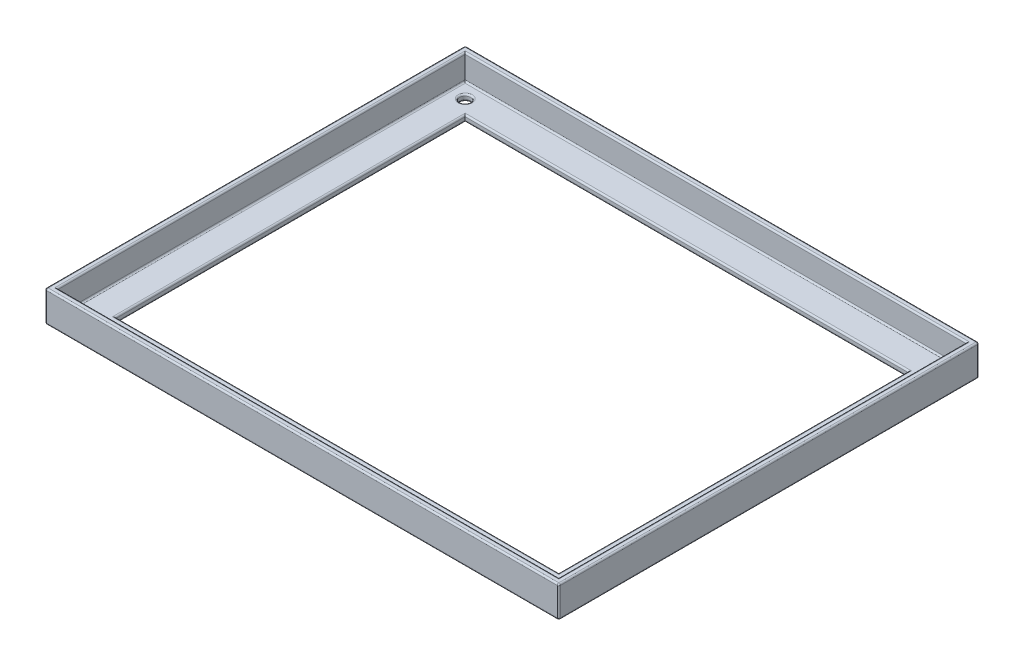
from build123d import *

# Parameters (mm, degrees)
SKETCH1_W           = 160.6
SKETCH1_H           = 130.6
SKETCH1_R           = 1.75
SKETCH1_W_2         = 142
SKETCH1_H_2         = 112
BOSS_EXTRUDE1_DEPTH = 2
SKETCH1_3_W         = 164.6
SKETCH1_3_H         = 134.6
SKETCH1_3_W_2       = 160.6
SKETCH1_3_H_2       = 130.6
BOSS_EXTRUDE2_DEPTH = 10
FILLET1_R           = 0.5


with BuildPart() as part:
    # Sketch1 → Boss-Extrude1 (new body)
    with BuildSketch(Plane(origin=(0, 0, 0), x_dir=(1, 0, 0), z_dir=(0, 1, 0))):
        with Locations((80, 65)):
            Rectangle(SKETCH1_W, SKETCH1_H)
        with Locations((4.5, 125.5)):
            Circle(SKETCH1_R, mode=Mode.SUBTRACT)
        with Locations((80, 65)):
            Rectangle(SKETCH1_W_2, SKETCH1_H_2, mode=Mode.SUBTRACT)
        with Locations((4.5, 4.5)):
            Circle(SKETCH1_R, mode=Mode.SUBTRACT)
        with Locations((155.5, 4.5)):
            Circle(SKETCH1_R, mode=Mode.SUBTRACT)
        with Locations((155.5, 125.5)):
            Circle(SKETCH1_R, mode=Mode.SUBTRACT)
    extrude(amount=BOSS_EXTRUDE1_DEPTH)

    # Sketch1<3> → Boss-Extrude2 (add)
    with BuildSketch(Plane(origin=(0, 0, 0), x_dir=(1, 0, 0), z_dir=(0, 1, 0))):
        with Locations((80, 65)):
            Rectangle(SKETCH1_3_W, SKETCH1_3_H)
        with Locations((80, 65)):
            Rectangle(SKETCH1_3_W_2, SKETCH1_3_H_2, mode=Mode.SUBTRACT)
    extrude(amount=BOSS_EXTRUDE2_DEPTH)

    # Fillet1
    fillet1_edges = [part.edges().sort_by_distance(p)[0] for p in [
        (162.3, 5, -132.3),
        (162.3, 5, 2.3),
        (-2.3, 5, -132.3),
        (-2.3, 5, 2.3),
        (-2.3, 0, -65),
        (80, 0, 2.3),
        (162.3, 0, -65),
        (80, 0, -132.3),
        (153.75, 0, -125.5),
        (153.75, 0, -4.5),
        (2.75, 0, -4.5),
        (2.75, 0, -125.5),
        (151, 0, -65),
        (80, 0, -9),
        (9, 0, -65),
        (80, 0, -121),
        (162.3, 10, -65),
        (80, 10, 2.3),
        (-2.3, 10, -65),
        (80, 10, -132.3),
        (80, 10, 0.3),
        (160.3, 10, -65),
        (80, 10, -130.3),
        (-0.3, 10, -65),
        (153.75, 2, -125.5),
        (153.75, 2, -4.5),
        (2.75, 2, -4.5),
        (2.75, 2, -125.5),
        (160.3, 2, -65),
        (80, 2, 0.3),
        (-0.3, 2, -65),
        (80, 2, -130.3),
        (9, 2, -65),
        (80, 2, -9),
        (151, 2, -65),
        (80, 2, -121),
    ]]
    fillet(fillet1_edges, radius=FILLET1_R)


solid = part.part
